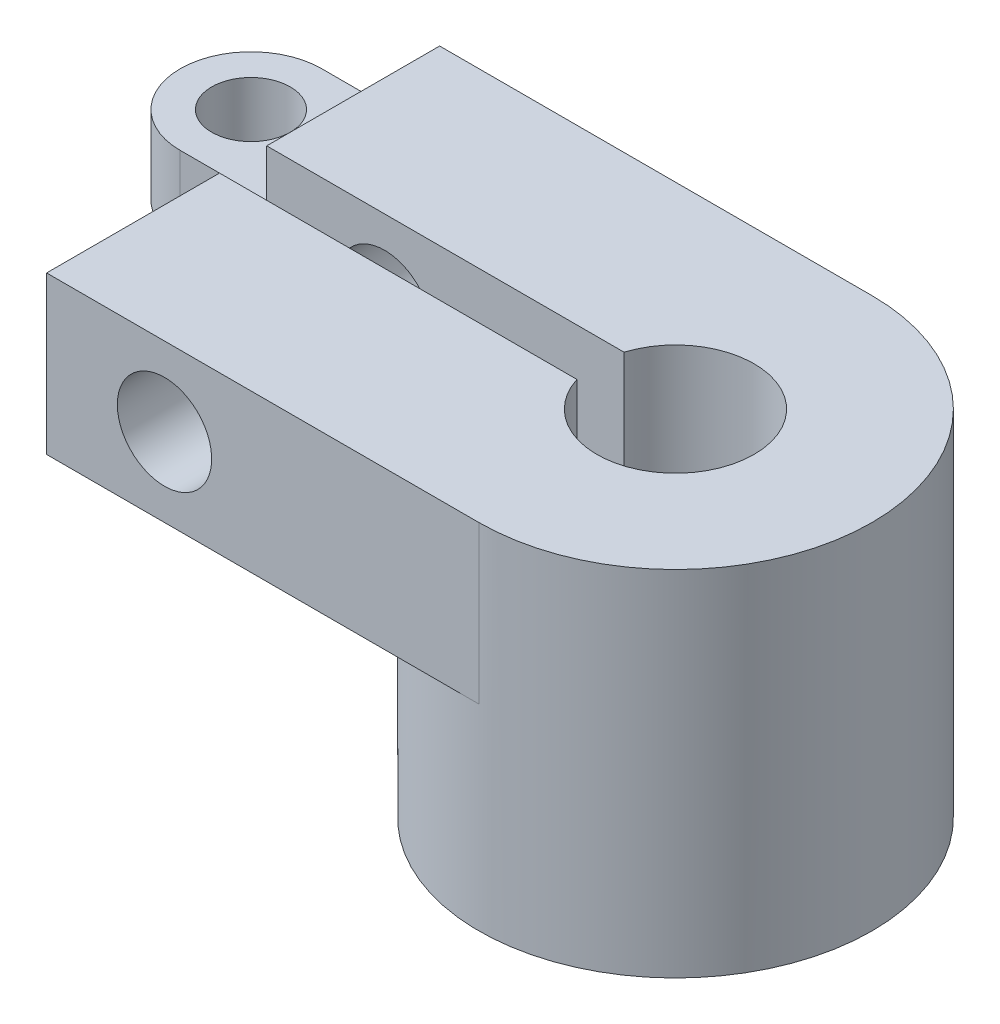
from build123d import *

# Parameters (mm, degrees)
BOSS_EXTRUDE1_DEPTH = 10
BOSS_EXTRUDE2_DEPTH = 45
SKETCH3_R           = 5
BOSS_EXTRUDE3_DEPTH = 10
HOLE1_D             = 12


with BuildPart() as part:
    # Sketch1 → Boss-Extrude1 (new, symmetric)
    with BuildSketch(Plane(origin=(0, 0, 0), x_dir=(1, 0, 0), z_dir=(0, 1, 0))):
        with BuildLine():
            Line((0, 25), (-55, 25))
            Line((-55, 25), (-55, 3))
            Line((-55, 3), (-9.539392014, 3))
            ThreePointArc((-9.539392014, 3), (10, 0), (-9.539392014, -3))
            Line((-9.539392014, -3), (-55, -3))
            Line((-55, -3), (-55, -25))
            Line((-55, -25), (0, -25))
            ThreePointArc((0, -25), (25, 0), (0, 25))
        make_face()
    extrude(amount=BOSS_EXTRUDE1_DEPTH, both=True)

    # Sketch2 → Boss-Extrude2 (add)
    with BuildSketch(Plane(origin=(0, 10, 0), x_dir=(1, 0, 0), z_dir=(0, 1, 0))):
        with BuildLine():
            Line((-9.539392014, -3), (-24.819347292, -3))
            ThreePointArc((-24.819347292, -3), (25, 0), (-24.819347292, 3))
            Line((-24.819347292, 3), (-9.539392014, 3))
            ThreePointArc((-9.539392014, 3), (10, 0), (-9.539392014, -3))
        make_face()
    extrude(amount=-BOSS_EXTRUDE2_DEPTH)

    # Sketch3 → Boss-Extrude3 (add)
    with BuildSketch(Plane.XZ.offset(10)):
        with BuildLine():
            Line((-55, -7), (-70, -7))
            ThreePointArc((-70, -7), (-79, -16), (-70, -25))
            Line((-70, -25), (-55, -25))
            Line((-55, -25), (-55, -7))
        make_face()
        with Locations(Location((-70, -16, 0), (0, 0, 270))):
            Circle(SKETCH3_R, mode=Mode.SUBTRACT)
    extrude(amount=-BOSS_EXTRUDE3_DEPTH)

    # Hole1 (through all)
    with Locations(Plane(origin=(0, 0, -25), x_dir=(-1, 0, 0), z_dir=(0, 0, -1))):
        with Locations((40, 0)):
            Hole(HOLE1_D / 2)


solid = part.part
